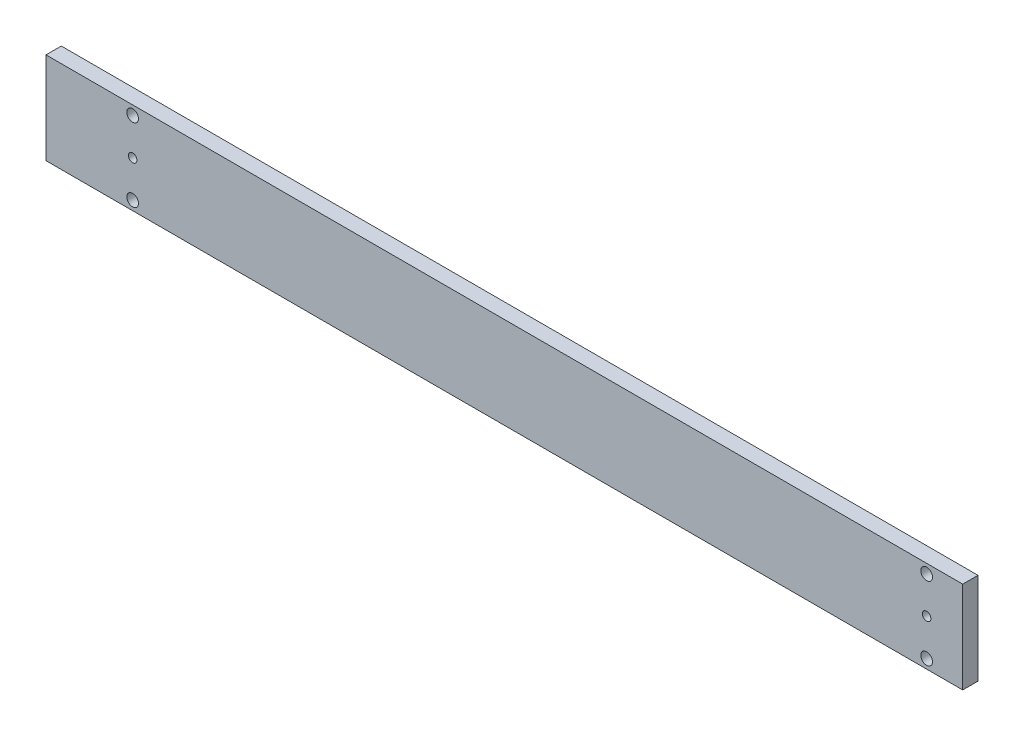
from build123d import *

# Parameters (mm, degrees)
SKETCH1_W           = 190.5
SKETCH1_H           = 19.05
SKETCH1_R           = 1.2192
SKETCH1_R_2         = 0.889
BOSS_EXTRUDE1_DEPTH = 3.175


with BuildPart() as part:
    # Sketch1 → Boss-Extrude1 (new body)
    with BuildSketch(Plane.XY):
        with Locations((95.25, 9.525)):
            Rectangle(SKETCH1_W, SKETCH1_H)
        with Locations((18, 17.145)):
            Circle(SKETCH1_R, mode=Mode.SUBTRACT)
        with Locations((18, 1.905)):
            Circle(SKETCH1_R, mode=Mode.SUBTRACT)
        with Locations((183, 17.145)):
            Circle(SKETCH1_R, mode=Mode.SUBTRACT)
        with Locations((183, 1.905)):
            Circle(SKETCH1_R, mode=Mode.SUBTRACT)
        with Locations((183, 9.525)):
            Circle(SKETCH1_R_2, mode=Mode.SUBTRACT)
        with Locations((18, 9.525)):
            Circle(SKETCH1_R_2, mode=Mode.SUBTRACT)
    extrude(amount=BOSS_EXTRUDE1_DEPTH)


solid = part.part
